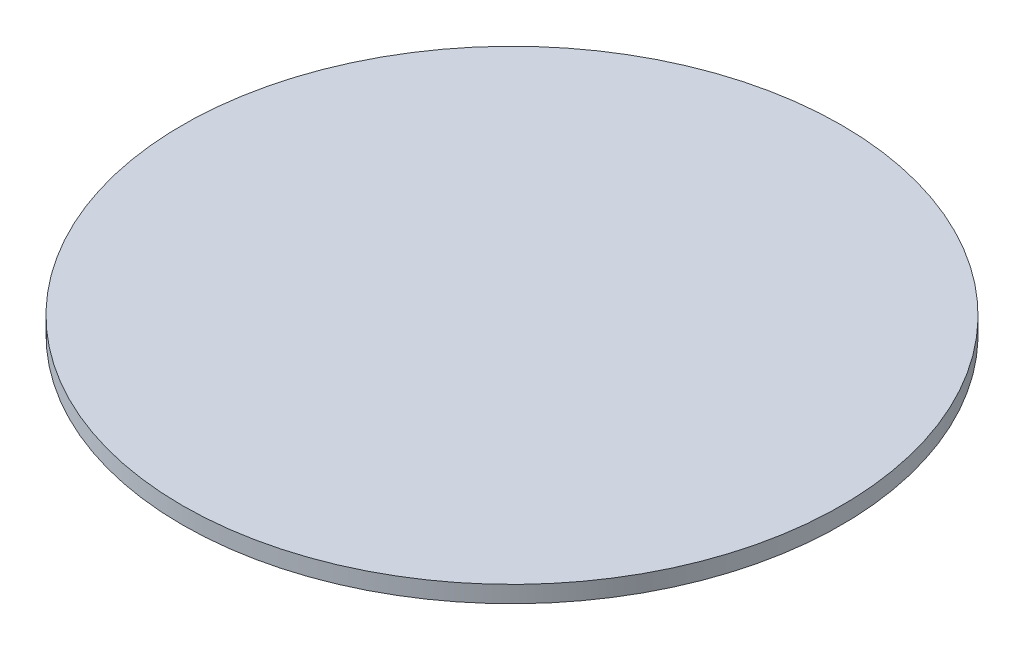
from build123d import *

# Parameters (mm, degrees)
SKETCH2_R           = 59
BOSS_EXTRUDE1_DEPTH = 3


with BuildPart() as part:
    # Sketch2 → Boss-Extrude1 (new body)
    with BuildSketch(Plane(origin=(0, 0, 0), x_dir=(1, 0, 0), z_dir=(0, 1, 0))):
        with Locations(Location((0, 0, 0), (0, 0, 270))):
            Circle(SKETCH2_R)
    extrude(amount=BOSS_EXTRUDE1_DEPTH)


solid = part.part
